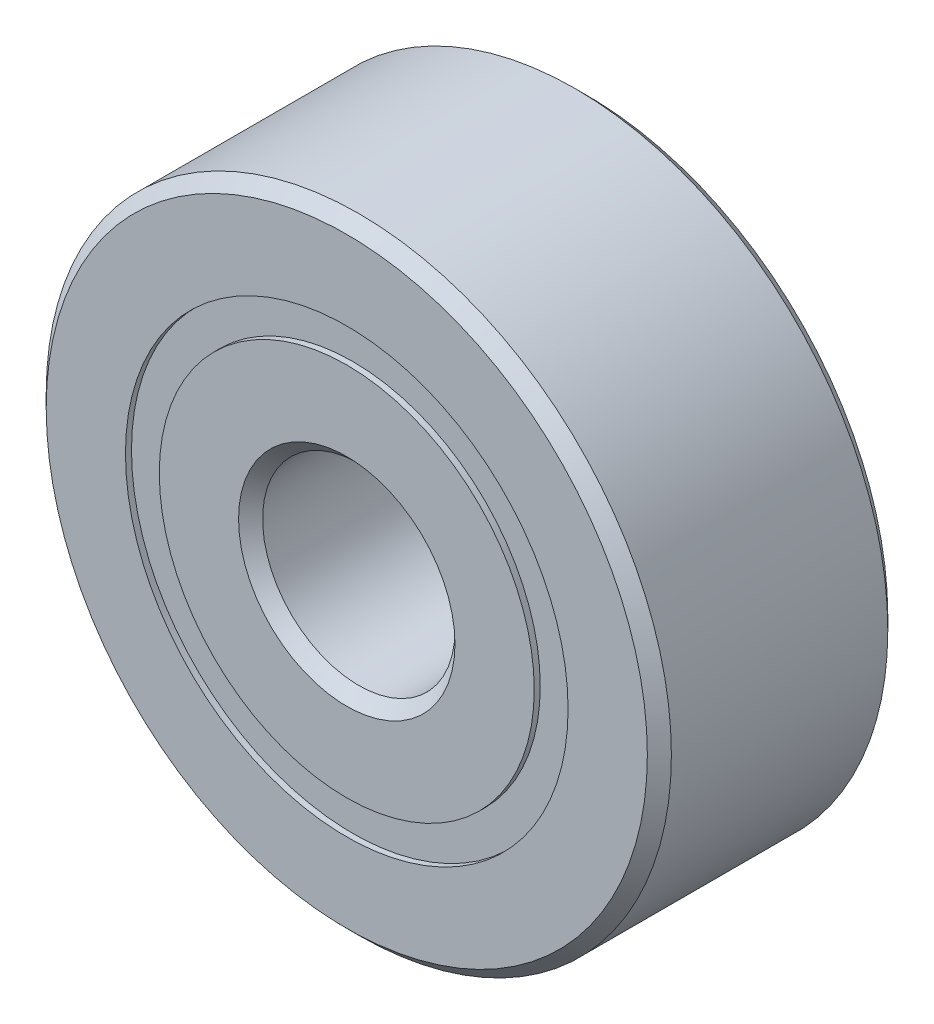
from build123d import *

# Parameters (mm, degrees)
CIRPATTERN1_COUNT = 12
SKETCH5_W         = 1.209571124
SKETCH5_H         = 0.703296704


with BuildPart() as part:
    # Sketch1 → Revolve1 (revolve)
    with BuildSketch(Plane(origin=(0, 0, 0), x_dir=(0, 0, -1), z_dir=(1, 0, 0))):
        with BuildLine():
            Line((2.25, 6.5), (-2.25, 6.5))
            Line((-2.25, 6.5), (-2.5, 6.25))
            Line((-2.5, 6.25), (-2.5, 4.601648352))
            Line((-2.5, 4.601648352), (-1.111111111, 4.601648352))
            ThreePointArc((-1.111111111, 4.601648352), (0, 5.415428876), (1.111111111, 4.601648352))
            Line((1.111111111, 4.601648352), (2.5, 4.601648352))
            Line((2.5, 4.601648352), (2.5, 6.25))
            Line((2.5, 6.25), (2.25, 6.5))
        make_face()
    revolve(axis=Axis((0, 0, 2.5), (0, 0, -1)))


with BuildPart() as body_2:
    # Sketch3 → Revolve3 (revolve)
    with BuildSketch(Plane(origin=(0, 0, 0), x_dir=(0, 0, -1), z_dir=(1, 0, 0))):
        with BuildLine():
            Line((-2.5, 3.898351648), (-1.111111111, 3.898351648))
            ThreePointArc((-1.111111111, 3.898351648), (0, 3.084571124), (1.111111111, 3.898351648))
            Line((1.111111111, 3.898351648), (2.5, 3.898351648))
            Line((2.5, 3.898351648), (2.5, 2.25))
            Line((2.5, 2.25), (2.25, 2))
            Line((2.25, 2), (-2.25, 2))
            Line((-2.25, 2), (-2.5, 2.25))
            Line((-2.5, 2.25), (-2.5, 3.898351648))
        make_face()
    revolve(axis=Axis((0, 0, 2.5), (0, 0, -1)))


with BuildPart() as body_3:
    # Sketch4 → Revolve4 (revolve)
    with BuildSketch(Plane(origin=(0, 0, 0), x_dir=(0, 0, -1), z_dir=(1, 0, 0))):
        with BuildLine():
            Line((-1.165428876, 4.25), (1.165428876, 4.25))
            ThreePointArc((1.165428876, 4.25), (0, 5.415428876), (-1.165428876, 4.25))
        make_face()
    revolve(axis=Axis((0, 4.25, 1.165428876), (0, 0, -1)))


with BuildPart() as cirpattern1_1:
    # CirPattern1: pattern copy
    add(body_3.part.rotate(Axis((0, 0, -2.5), (0, 0, 1)), 1 * 360 / CIRPATTERN1_COUNT))


with BuildPart() as cirpattern1_2:
    # CirPattern1: pattern copy
    add(body_3.part.rotate(Axis((0, 0, -2.5), (0, 0, 1)), 2 * 360 / CIRPATTERN1_COUNT))


with BuildPart() as cirpattern1_3:
    # CirPattern1: pattern copy
    add(body_3.part.rotate(Axis((0, 0, -2.5), (0, 0, 1)), 3 * 360 / CIRPATTERN1_COUNT))


with BuildPart() as cirpattern1_4:
    # CirPattern1: pattern copy
    add(body_3.part.rotate(Axis((0, 0, -2.5), (0, 0, 1)), 4 * 360 / CIRPATTERN1_COUNT))


with BuildPart() as cirpattern1_5:
    # CirPattern1: pattern copy
    add(body_3.part.rotate(Axis((0, 0, -2.5), (0, 0, 1)), 5 * 360 / CIRPATTERN1_COUNT))


with BuildPart() as cirpattern1_6:
    # CirPattern1: pattern copy
    add(body_3.part.rotate(Axis((0, 0, -2.5), (0, 0, 1)), 6 * 360 / CIRPATTERN1_COUNT))


with BuildPart() as cirpattern1_7:
    # CirPattern1: pattern copy
    add(body_3.part.rotate(Axis((0, 0, -2.5), (0, 0, 1)), 7 * 360 / CIRPATTERN1_COUNT))


with BuildPart() as cirpattern1_8:
    # CirPattern1: pattern copy
    add(body_3.part.rotate(Axis((0, 0, -2.5), (0, 0, 1)), 8 * 360 / CIRPATTERN1_COUNT))


with BuildPart() as cirpattern1_9:
    # CirPattern1: pattern copy
    add(body_3.part.rotate(Axis((0, 0, -2.5), (0, 0, 1)), 9 * 360 / CIRPATTERN1_COUNT))


with BuildPart() as cirpattern1_10:
    # CirPattern1: pattern copy
    add(body_3.part.rotate(Axis((0, 0, -2.5), (0, 0, 1)), 10 * 360 / CIRPATTERN1_COUNT))


with BuildPart() as cirpattern1_11:
    # CirPattern1: pattern copy
    add(body_3.part.rotate(Axis((0, 0, -2.5), (0, 0, 1)), 11 * 360 / CIRPATTERN1_COUNT))


with BuildPart() as body_15:
    # Sketch5 → Revolve5 (revolve)
    with BuildSketch(Plane(origin=(0, 0, 0), x_dir=(0, 0, -1), z_dir=(1, 0, 0))):
        with Locations((-1.770214438, 4.25)):
            Rectangle(SKETCH5_W, SKETCH5_H)
        with Locations((1.770214438, 4.25)):
            Rectangle(SKETCH5_W, SKETCH5_H)
    revolve(axis=Axis((0, 0, 2.5), (0, 0, -1)))


solid = Compound([part.part, body_2.part, body_3.part, cirpattern1_1.part, cirpattern1_2.part, cirpattern1_3.part, cirpattern1_4.part, cirpattern1_5.part, cirpattern1_6.part, cirpattern1_7.part, cirpattern1_8.part, cirpattern1_9.part, cirpattern1_10.part, cirpattern1_11.part, body_15.part])
